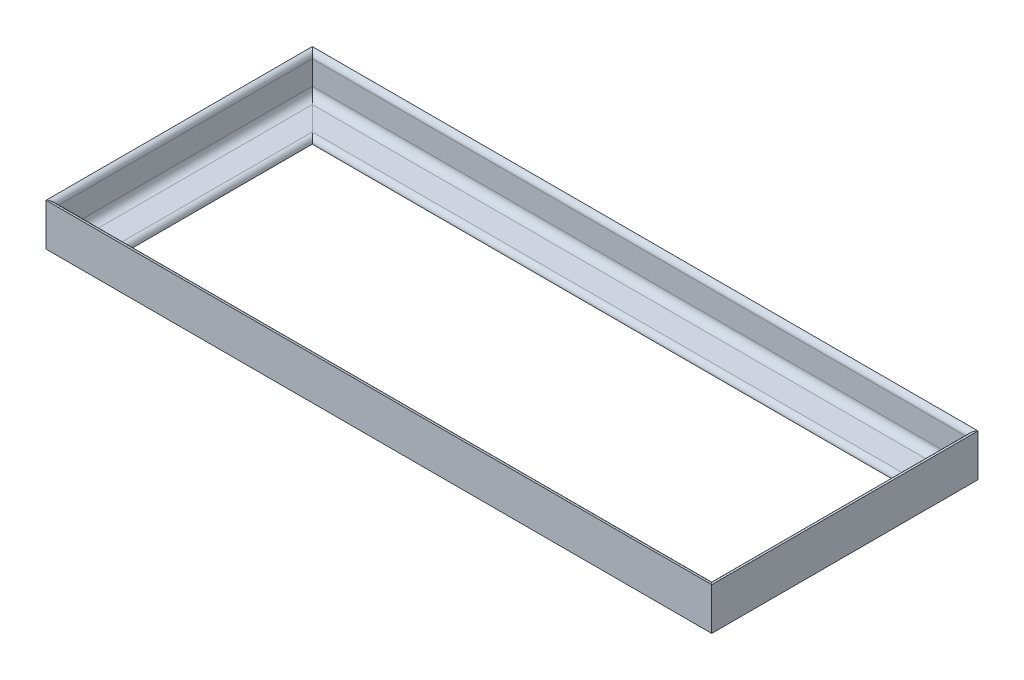
from build123d import *

# Parameters (mm, degrees)
HIERRO_ANGULAR_1_X_1_X_0_125_1_DEPTH      = 436.921024484
HIERRO_ANGULAR_1_X_1_X_0_125_1_DEPTH_BACK = 36.921024484
HIERRO_ANGULAR_1_X_1_X_0_125_1_2_DEPTH    = 233.842048969
HIERRO_ANGULAR_1_X_1_X_0_125_1_3_DEPTH    = 473.842048969
HIERRO_ANGULAR_1_X_1_X_0_125_1_4_DEPTH    = 233.842048969


with BuildPart() as part:
    # Sketch1 → Hierro angular 1 X 1 X 0.125(1) (new, two sides: drawn at the far end of the back side and taken through both)
    with BuildSketch(Plane(origin=(200, 0, -80), x_dir=(0, 0, 1), z_dir=(-1, 0, 0)).offset(-HIERRO_ANGULAR_1_X_1_X_0_125_1_DEPTH_BACK)):
        with BuildLine():
            Line((0, 0), (0, 25.4))
            Line((0, 25.4), (0.00508, 25.4))
            ThreePointArc((0.00508, 25.4), (2.246551928, 24.471551928), (3.175, 22.23008))
            Line((3.175, 22.23008), (3.175, 7.9375))
            ThreePointArc((3.175, 7.9375), (4.569903955, 4.569903955), (7.9375, 3.175))
            Line((7.9375, 3.175), (22.23008, 3.175))
            ThreePointArc((22.23008, 3.175), (24.471551928, 2.246551928), (25.4, 0.00508))
            Line((25.4, 0.00508), (25.4, 0))
            Line((25.4, 0), (0, 0))
        make_face()
    extrude(amount=HIERRO_ANGULAR_1_X_1_X_0_125_1_DEPTH + HIERRO_ANGULAR_1_X_1_X_0_125_1_DEPTH_BACK)

    # Hierro angular 1 X 1 X 0.125(1) mitre 1
    split(bisect_by=Plane(origin=(200, 0, -80), x_dir=(0, -1, 0), z_dir=(-0.707106781, 0, -0.707106781)), keep=Keep.TOP)

    # Hierro angular 1 X 1 X 0.125(1) mitre 2
    split(bisect_by=Plane(origin=(-200, 0, -80), x_dir=(0, 1, 0), z_dir=(0.707106781, 0, -0.707106781)), keep=Keep.TOP)


with BuildPart() as body_2:
    # Sketch1 on segment 2 (carried to segment 2) → Hierro angular 1 X 1 X 0.125_1 2 (new body)
    with BuildSketch(Plane(origin=(-200, 0, -116.921024484), x_dir=(1, 0, 0), z_dir=(0, 0, 1))):
        with BuildLine():
            Line((0, 0), (0, 25.4))
            Line((0, 25.4), (0.00508, 25.4))
            ThreePointArc((0.00508, 25.4), (2.246551928, 24.471551928), (3.175, 22.23008))
            Line((3.175, 22.23008), (3.175, 7.9375))
            ThreePointArc((3.175, 7.9375), (4.569903955, 4.569903955), (7.9375, 3.175))
            Line((7.9375, 3.175), (22.23008, 3.175))
            ThreePointArc((22.23008, 3.175), (24.471551928, 2.246551928), (25.4, 0.00508))
            Line((25.4, 0.00508), (25.4, 0))
            Line((25.4, 0), (0, 0))
        make_face()
    extrude(amount=HIERRO_ANGULAR_1_X_1_X_0_125_1_2_DEPTH)

    # Hierro angular 1 X 1 X 0.125_1 2 mitre 1
    split(bisect_by=Plane(origin=(-200, 0, 80), x_dir=(0, -1, 0), z_dir=(-0.707106781, 0, -0.707106781)), keep=Keep.TOP)

    # Hierro angular 1 X 1 X 0.125_1 2 mitre 2
    split(bisect_by=Plane(origin=(-200, 0, -80), x_dir=(0, -1, 0), z_dir=(-0.707106781, 0, 0.707106781)), keep=Keep.TOP)


with BuildPart() as body_3:
    # Sketch1 on segment 3 (carried to segment 3) → Hierro angular 1 X 1 X 0.125_1 3 (new body)
    with BuildSketch(Plane(origin=(-236.921024484, 0, 80), x_dir=(0, 0, -1), z_dir=(1, 0, 0))):
        with BuildLine():
            Line((0, 0), (0, 25.4))
            Line((0, 25.4), (0.00508, 25.4))
            ThreePointArc((0.00508, 25.4), (2.246551928, 24.471551928), (3.175, 22.23008))
            Line((3.175, 22.23008), (3.175, 7.9375))
            ThreePointArc((3.175, 7.9375), (4.569903955, 4.569903955), (7.9375, 3.175))
            Line((7.9375, 3.175), (22.23008, 3.175))
            ThreePointArc((22.23008, 3.175), (24.471551928, 2.246551928), (25.4, 0.00508))
            Line((25.4, 0.00508), (25.4, 0))
            Line((25.4, 0), (0, 0))
        make_face()
    extrude(amount=HIERRO_ANGULAR_1_X_1_X_0_125_1_3_DEPTH)

    # Hierro angular 1 X 1 X 0.125_1 3 mitre 1
    split(bisect_by=Plane(origin=(200, 0, 80), x_dir=(0, -1, 0), z_dir=(-0.707106781, 0, 0.707106781)), keep=Keep.TOP)

    # Hierro angular 1 X 1 X 0.125_1 3 mitre 2
    split(bisect_by=Plane(origin=(-200, 0, 80), x_dir=(0, 1, 0), z_dir=(0.707106781, 0, 0.707106781)), keep=Keep.TOP)


with BuildPart() as body_4:
    # Sketch1 on segment 4 (carried to segment 4) → Hierro angular 1 X 1 X 0.125_1 4 (new body)
    with BuildSketch(Plane(origin=(200, 0, 116.921024484), x_dir=(-1, 0, 0), z_dir=(0, 0, -1))):
        with BuildLine():
            Line((0, 0), (0, 25.4))
            Line((0, 25.4), (0.00508, 25.4))
            ThreePointArc((0.00508, 25.4), (2.246551928, 24.471551928), (3.175, 22.23008))
            Line((3.175, 22.23008), (3.175, 7.9375))
            ThreePointArc((3.175, 7.9375), (4.569903955, 4.569903955), (7.9375, 3.175))
            Line((7.9375, 3.175), (22.23008, 3.175))
            ThreePointArc((22.23008, 3.175), (24.471551928, 2.246551928), (25.4, 0.00508))
            Line((25.4, 0.00508), (25.4, 0))
            Line((25.4, 0), (0, 0))
        make_face()
    extrude(amount=HIERRO_ANGULAR_1_X_1_X_0_125_1_4_DEPTH)

    # Hierro angular 1 X 1 X 0.125_1 4 mitre 1
    split(bisect_by=Plane(origin=(200, 0, 80), x_dir=(0, 1, 0), z_dir=(0.707106781, 0, -0.707106781)), keep=Keep.TOP)

    # Hierro angular 1 X 1 X 0.125_1 4 mitre 2
    split(bisect_by=Plane(origin=(200, 0, -80), x_dir=(0, 1, 0), z_dir=(0.707106781, 0, 0.707106781)), keep=Keep.TOP)


solid = Compound([part.part, body_2.part, body_3.part, body_4.part])
